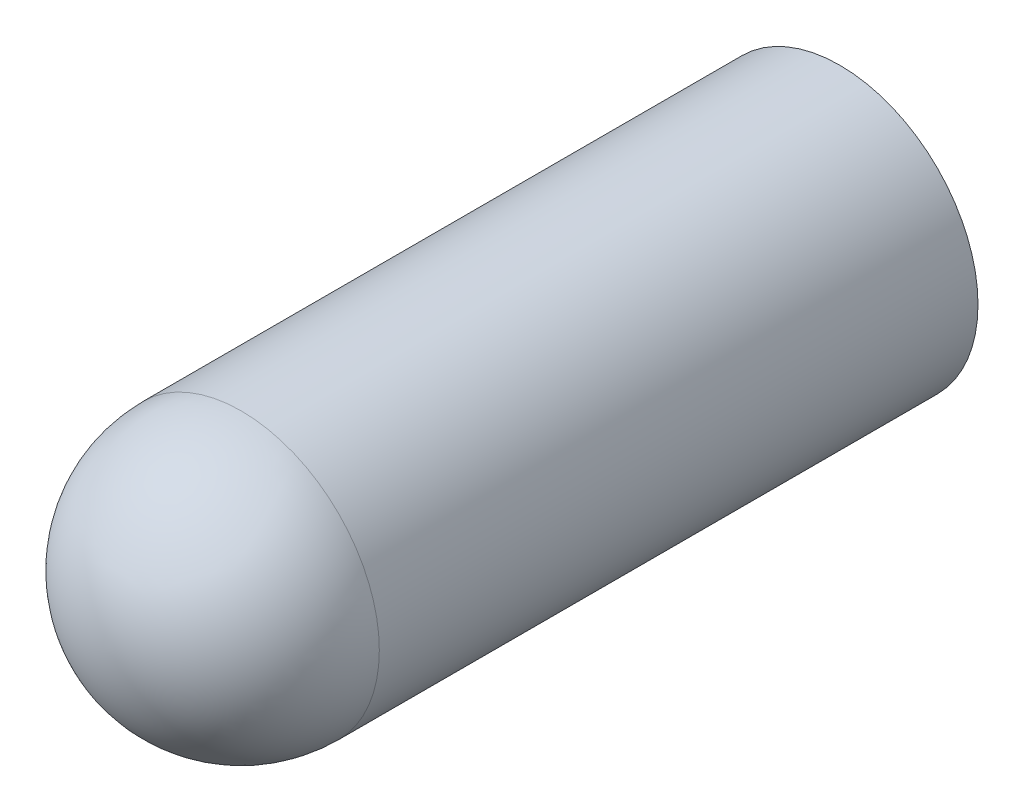
from build123d import *

# Parameters (mm, degrees)
SKETCH_1_R      = 1.5
EXTRUDE_1_DEPTH = 8
FILLET_1_R      = 1.5


with BuildPart() as part:
    # 草图1 → 凸台-拉伸1 (new body)
    with BuildSketch(Plane.XY):
        Circle(SKETCH_1_R)
    extrude(amount=EXTRUDE_1_DEPTH)

    # 圆角1
    fillet_1_edges = [part.edges().sort_by_distance(p)[0] for p in [
        (-1.5, 0, 8),
    ]]
    fillet(fillet_1_edges, radius=FILLET_1_R)


solid = part.part
